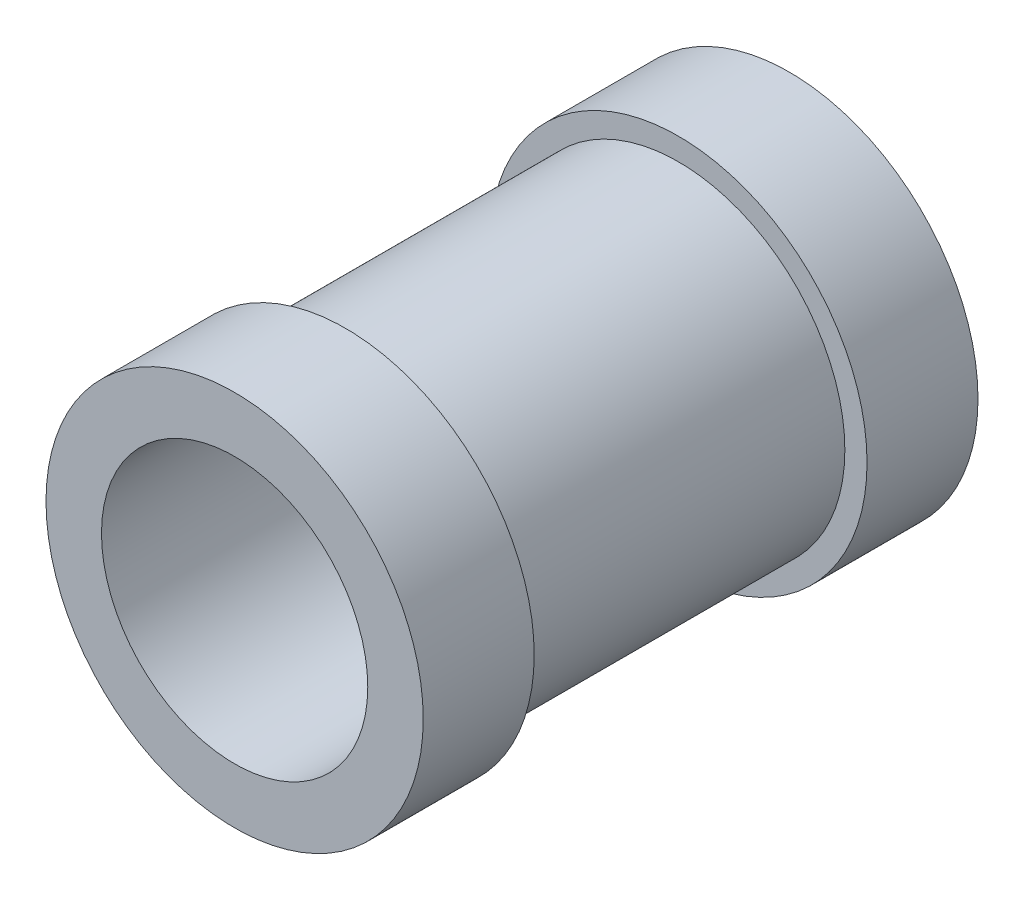
from build123d import *

# Parameters (mm, degrees)
SKETCH1_R           = 1.5
SKETCH1_R_2         = 1.2
BOSS_EXTRUDE1_DEPTH = 5
BOSS_EXTRUDE2_START = -1
SKETCH2_R           = 1.7
SKETCH2_R_2         = 1.2
BOSS_EXTRUDE2_DEPTH = 1
SKETCH3_R           = 1.7
SKETCH3_R_2         = 1.2
BOSS_EXTRUDE3_DEPTH = 1


with BuildPart() as part:
    # Sketch1 → Boss-Extrude1 (new body)
    with BuildSketch(Plane.XY):
        with Locations((15, 15)):
            Circle(SKETCH1_R)
        with Locations((15, 15)):
            Circle(SKETCH1_R_2, mode=Mode.SUBTRACT)
    extrude(amount=BOSS_EXTRUDE1_DEPTH)

    # Sketch2 → Boss-Extrude2 (add)
    with BuildSketch(Plane.XY.offset(5).offset(BOSS_EXTRUDE2_START)):
        with Locations((15, 15)):
            Circle(SKETCH2_R)
        with Locations((15, 15)):
            Circle(SKETCH2_R_2, mode=Mode.SUBTRACT)
    extrude(amount=BOSS_EXTRUDE2_DEPTH)

    # Sketch3 → Boss-Extrude3 (add)
    with BuildSketch(Plane(origin=(0, 0, 0), x_dir=(-1, 0, 0), z_dir=(0, 0, -1))):
        with Locations(Location((-15, 15, 0), (0, 0, 180))):
            Circle(SKETCH3_R)
        with Locations(Location((-15, 15, 0), (0, 0, 180))):
            Circle(SKETCH3_R_2, mode=Mode.SUBTRACT)
    extrude(amount=-BOSS_EXTRUDE3_DEPTH)


solid = part.part
